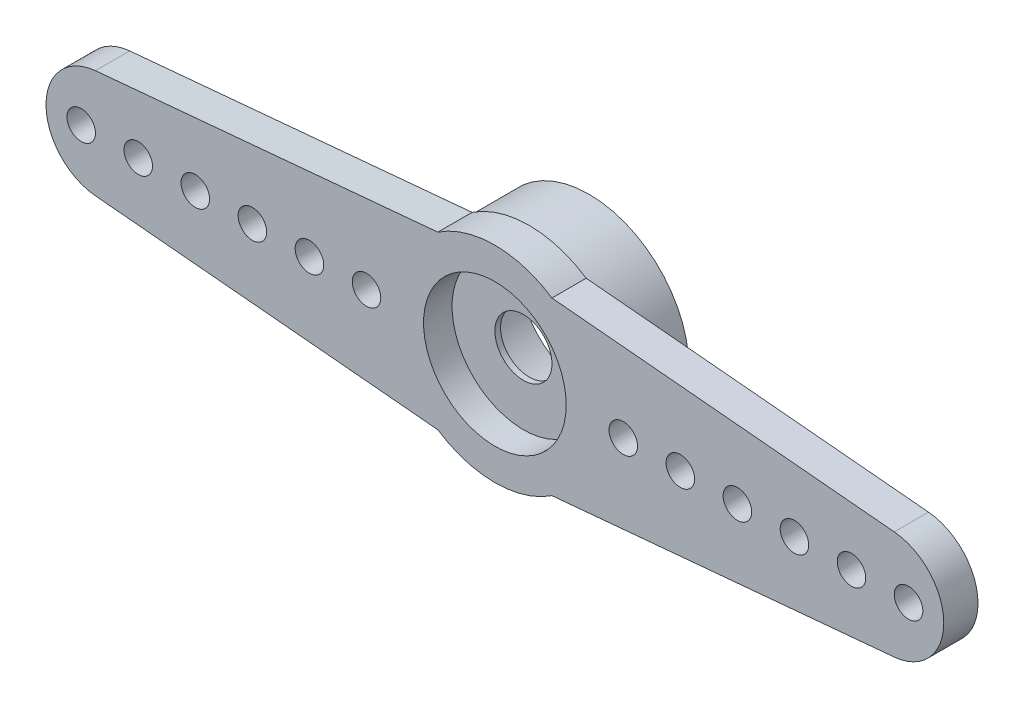
from build123d import *

# Parameters (mm, degrees)
BOSS_EXTRUDE1_DEPTH = 1.2
SKETCH2_R           = 3.5
BOSS_EXTRUDE2_DEPTH = 2.1
SKETCH3_R           = 2.5
CUT_EXTRUDE1_DEPTH  = 1
SKETCH4_R           = 1
CUT_EXTRUDE2_DEPTH  = 19.149516235
SKETCH6_R           = 2.45
CUT_EXTRUDE3_DEPTH  = 2.1
SKETCH7_R           = 0.5
CUT_EXTRUDE4_DEPTH  = 19.303140156
SKETCH8_R           = 0.5
CUT_EXTRUDE5_DEPTH  = 19.303140156
CUT_EXTRUDE6_DEPTH  = 10


with BuildPart() as part:
    # Sketch1 → Boss-Extrude1 (new body)
    with BuildSketch(Plane.XY):
        with BuildLine():
            Line((-2, -6.75), (-2, -3))
            Line((-2, -3), (-14, -1.9))
            ThreePointArc((-14, -1.9), (-15.733799273, 0), (-14, 1.9))
            Line((-14, 1.9), (-2, 3))
            Line((-2, 3), (-2, 6.75))
            ThreePointArc((-2, 6.75), (0, 8.75), (2, 6.75))
            Line((2, 6.75), (2, 3))
            Line((2, 3), (14, 1.9))
            ThreePointArc((14, 1.9), (15.733799273, 0), (14, -1.9))
            Line((14, -1.9), (2, -3))
            Line((2, -3), (2, -6.75))
            ThreePointArc((2, -6.75), (0, -8.75), (-2, -6.75))
        make_face()
    extrude(amount=BOSS_EXTRUDE1_DEPTH)

    # Sketch2 → Boss-Extrude2 (add)
    with BuildSketch(Plane(origin=(0, 0, 0), x_dir=(-1, 0, 0), z_dir=(0, 0, -1))):
        Circle(SKETCH2_R)
    extrude(amount=BOSS_EXTRUDE2_DEPTH)

    # Sketch3 → Cut-Extrude1 (cut)
    with BuildSketch(Plane.XY.offset(1.2)):
        Circle(SKETCH3_R)
    extrude(amount=-CUT_EXTRUDE1_DEPTH, mode=Mode.SUBTRACT)

    # Sketch4 → Cut-Extrude2 (cut, through all)
    with BuildSketch(Plane.XY.offset(0.2)):
        Circle(SKETCH4_R)
    extrude(amount=-CUT_EXTRUDE2_DEPTH, mode=Mode.SUBTRACT)

    # Sketch6 → Cut-Extrude3 (cut)
    with BuildSketch(Plane(origin=(0, 0, -2.1), x_dir=(-1, 0, 0), z_dir=(0, 0, -1))):
        Circle(SKETCH6_R)
    extrude(amount=-CUT_EXTRUDE3_DEPTH, mode=Mode.SUBTRACT)

    # Sketch7 → Cut-Extrude4 (cut, through all)
    with BuildSketch(Plane.XY.offset(1.2)):
        with Locations((0, -4.5)):
            Circle(SKETCH7_R)
        with Locations((0, -6.5)):
            Circle(SKETCH7_R)
        with Locations((0, 4.5)):
            Circle(SKETCH7_R)
        with Locations((0, 6.5)):
            Circle(SKETCH7_R)
    extrude(amount=-CUT_EXTRUDE4_DEPTH, mode=Mode.SUBTRACT)

    # Sketch8 → Cut-Extrude5 (cut, through all)
    with BuildSketch(Plane.XY.offset(1.2)):
        with Locations((-4.5, 0)):
            Circle(SKETCH8_R)
        with Locations((-6.5, 0)):
            Circle(SKETCH8_R)
        with Locations((-8.5, 0)):
            Circle(SKETCH8_R)
        with Locations((-10.5, 0)):
            Circle(SKETCH8_R)
        with Locations((-12.5, 0)):
            Circle(SKETCH8_R)
        with Locations((-14.5, 0)):
            Circle(SKETCH8_R)
        with Locations(Location((4.5, 0, 0), (0, 0, 180))):
            Circle(SKETCH8_R)
        with Locations(Location((6.5, 0, 0), (0, 0, 180))):
            Circle(SKETCH8_R)
        with Locations(Location((8.5, 0, 0), (0, 0, 180))):
            Circle(SKETCH8_R)
        with Locations(Location((10.5, 0, 0), (0, 0, 180))):
            Circle(SKETCH8_R)
        with Locations(Location((12.5, 0, 0), (0, 0, 180))):
            Circle(SKETCH8_R)
        with Locations(Location((14.5, 0, 0), (0, 0, 180))):
            Circle(SKETCH8_R)
    extrude(amount=-CUT_EXTRUDE5_DEPTH, mode=Mode.SUBTRACT)

    # Sketch10 → Cut-Extrude6 (cut)
    with BuildSketch(Plane(origin=(0, 0, 0), x_dir=(-1, 0, 0), z_dir=(0, 0, -1))):
        with BuildLine():
            Line((-2, 3), (-3.5, 8.058048999))
            Line((-3.5, 8.058048999), (0.410688034, 10.263711762))
            Line((0.410688034, 10.263711762), (4.972399658, 6.328608878))
            Line((4.972399658, 6.328608878), (2, 3))
            ThreePointArc((2, 3), (0, 3.605551275), (-2, 3))
        make_face()
        with BuildLine():
            Line((-2, -3), (-3.79905406, -6.652770289))
            Line((-3.79905406, -6.652770289), (-0.630835306, -10.284036399))
            Line((-0.630835306, -10.284036399), (2.565835598, -9.787591171))
            Line((2.565835598, -9.787591171), (3.731558209, -4.826385145))
            Line((3.731558209, -4.826385145), (2, -3))
            ThreePointArc((2, -3), (0, -3.605551275), (-2, -3))
        make_face()
    extrude(amount=-CUT_EXTRUDE6_DEPTH, mode=Mode.SUBTRACT)


solid = part.part
